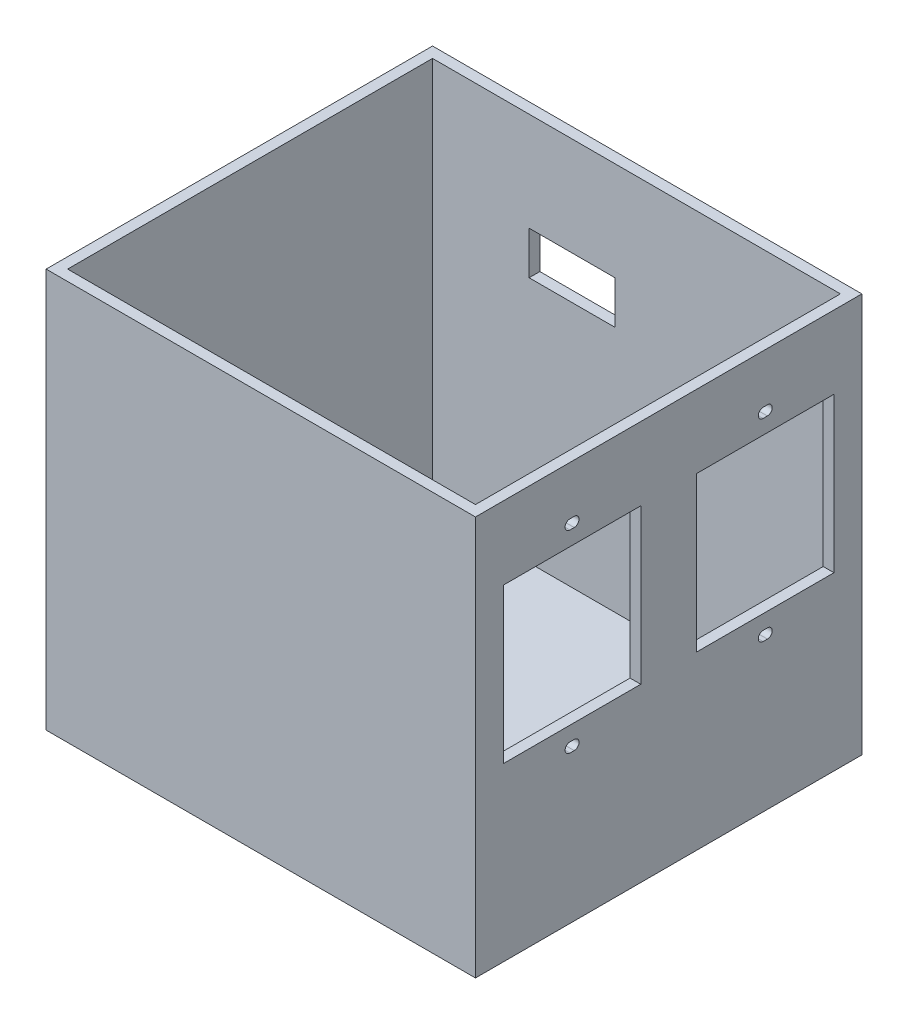
from build123d import *

# Parameters (mm, degrees)
SKETCH1_W           = 100
SKETCH1_H           = 90
BOSS_EXTRUDE1_DEPTH = 2.5
SKETCH1_3_W         = 100
SKETCH1_3_H         = 90
SKETCH1_3_W_2       = 95
SKETCH1_3_H_2       = 85
BOSS_EXTRUDE2_DEPTH = 93
SKETCH2_W           = 32
SKETCH2_H           = 36
CUT_EXTRUDE1_DEPTH  = 5
SKETCH3_W           = 20
SKETCH3_H           = 10
CUT_EXTRUDE2_DEPTH  = 5


with BuildPart() as part:
    # Sketch1 → Boss-Extrude1 (new body)
    with BuildSketch(Plane(origin=(0, 0, 0), x_dir=(1, 0, 0), z_dir=(0, 1, 0))):
        Rectangle(SKETCH1_W, SKETCH1_H)
    extrude(amount=BOSS_EXTRUDE1_DEPTH)

    # Sketch1<3> → Boss-Extrude2 (add)
    with BuildSketch(Plane(origin=(0, 0, 0), x_dir=(1, 0, 0), z_dir=(0, 1, 0))):
        Rectangle(SKETCH1_3_W, SKETCH1_3_H)
        Rectangle(SKETCH1_3_W_2, SKETCH1_3_H_2, mode=Mode.SUBTRACT)
    extrude(amount=BOSS_EXTRUDE2_DEPTH)

    # Sketch2 → Cut-Extrude1 (cut)
    with BuildSketch(Plane(origin=(50, 0, 0), x_dir=(0, 0, -1), z_dir=(1, 0, 0))):
        with Locations((-22.5, 58)):
            Rectangle(SKETCH2_W, SKETCH2_H)
        with BuildLine():
            Line((-23, 81.625), (-22, 81.625))
            ThreePointArc((-22, 81.625), (-20.875, 80.5), (-22, 79.375))
            Line((-22, 79.375), (-23, 79.375))
            ThreePointArc((-23, 79.375), (-24.125, 80.5), (-23, 81.625))
        make_face()
        with BuildLine():
            Line((-23, 34.375), (-22, 34.375))
            ThreePointArc((-22, 34.375), (-20.875, 35.5), (-22, 36.625))
            Line((-22, 36.625), (-23, 36.625))
            ThreePointArc((-23, 36.625), (-24.125, 35.5), (-23, 34.375))
        make_face()
        with Locations((22.5, 58)):
            Rectangle(SKETCH2_W, SKETCH2_H)
        with BuildLine():
            Line((23, 34.375), (22, 34.375))
            ThreePointArc((22, 34.375), (20.875, 35.5), (22, 36.625))
            Line((22, 36.625), (23, 36.625))
            ThreePointArc((23, 36.625), (24.125, 35.5), (23, 34.375))
        make_face()
        with BuildLine():
            Line((23, 81.625), (22, 81.625))
            ThreePointArc((22, 81.625), (20.875, 80.5), (22, 79.375))
            Line((22, 79.375), (23, 79.375))
            ThreePointArc((23, 79.375), (24.125, 80.5), (23, 81.625))
        make_face()
    extrude(amount=-CUT_EXTRUDE1_DEPTH, mode=Mode.SUBTRACT)

    # Sketch3 → Cut-Extrude2 (cut)
    with BuildSketch(Plane(origin=(0, 0, -45), x_dir=(-1, 0, 0), z_dir=(0, 0, -1))):
        with Locations((15, 65)):
            Rectangle(SKETCH3_W, SKETCH3_H)
    extrude(amount=-CUT_EXTRUDE2_DEPTH, mode=Mode.SUBTRACT)


solid = part.part
